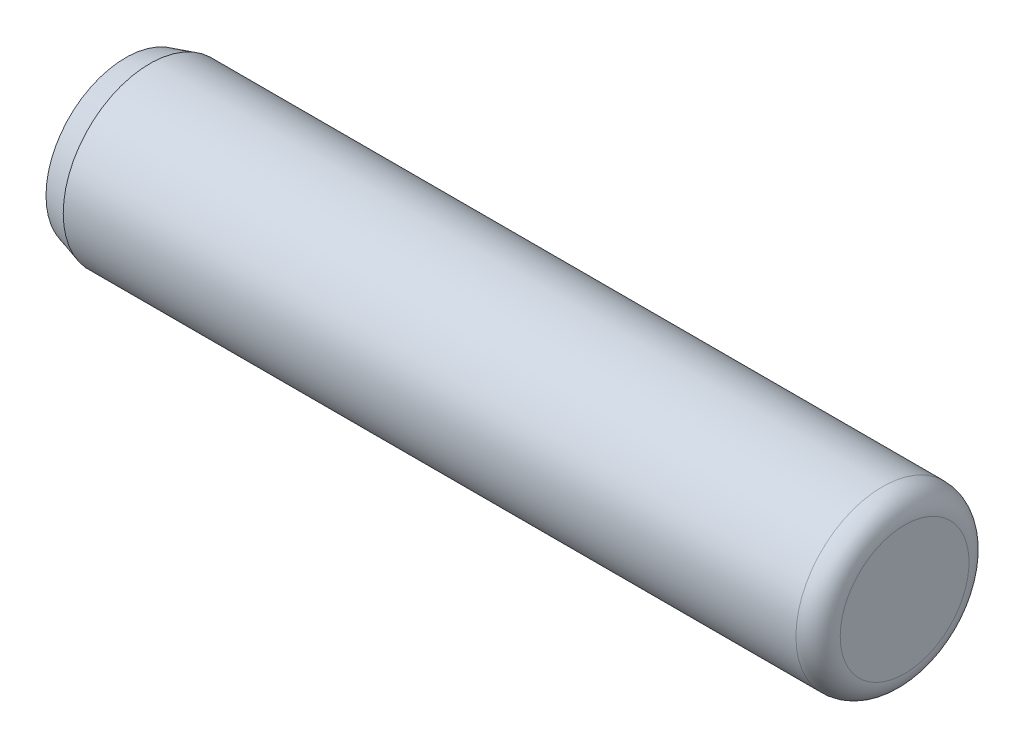
from build123d import *


with BuildPart() as part:
    # Sketch3 → Revolve1 (revolve)
    with BuildSketch(Plane.XY, mode=Mode.PRIVATE) as revolve1_sk:
        with BuildLine():
            Line((7.14375, 1.1811), (7.14375, 0))
            Line((7.14375, 0), (-7.14375, 0))
            Line((-7.14375, 0), (-7.14375, 1.4605))
            Line((-7.14375, 1.4605), (-6.700848366, 1.5875))
            Line((-6.700848366, 1.5875), (6.73735, 1.5875))
            ThreePointArc((6.73735, 1.5875), (7.024718196, 1.468468196), (7.14375, 1.1811))
        make_face()
    revolve(revolve1_sk.sketch.rotate(Axis((-7.14375, 0, 0), (1, 0, 0)), 90), axis=Axis((-7.14375, 0, 0), (1, 0, 0)))


solid = part.part
